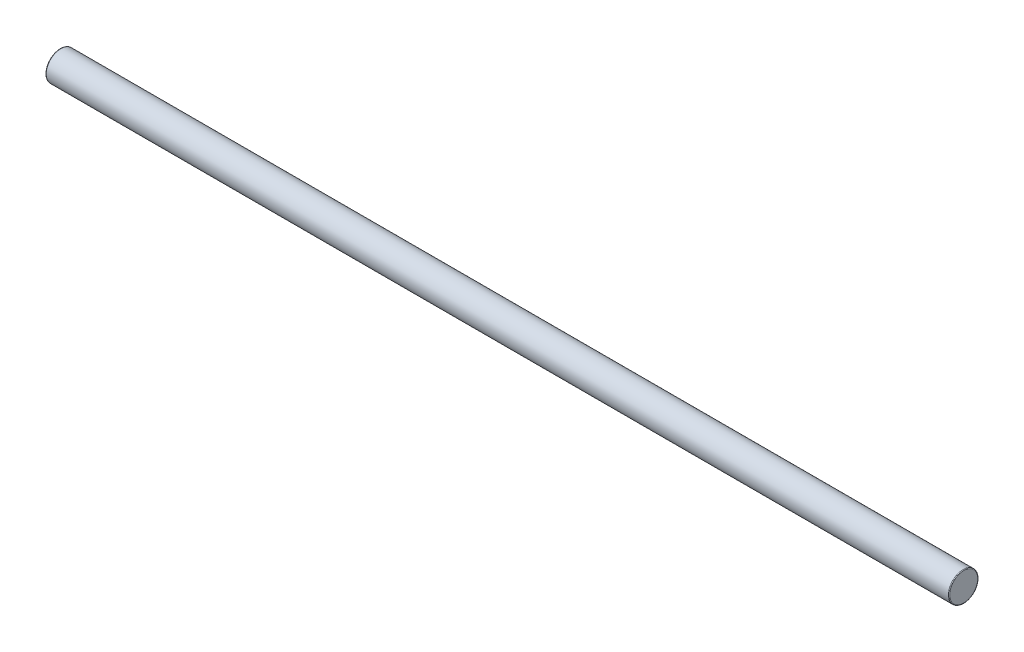
from build123d import *

# Parameters (mm, degrees)
SKETCH1_R           = 31.73095
BOSS_EXTRUDE1_DEPTH = 1952.752
FILLET1_R           = 1.524


with BuildPart() as part:
    # Sketch1 → Boss-Extrude1 (new body)
    with BuildSketch(Plane.YZ):
        with Locations(Location((0, 0, 0), (0, 0, 270))):
            Circle(SKETCH1_R)
    extrude(amount=BOSS_EXTRUDE1_DEPTH)

    # Fillet1
    fillet1_edges = [part.edges().sort_by_distance(p)[0] for p in [
        (0, 0, 31.73095),
        (1952.752, 0, 31.73095),
    ]]
    fillet(fillet1_edges, radius=FILLET1_R)


solid = part.part
